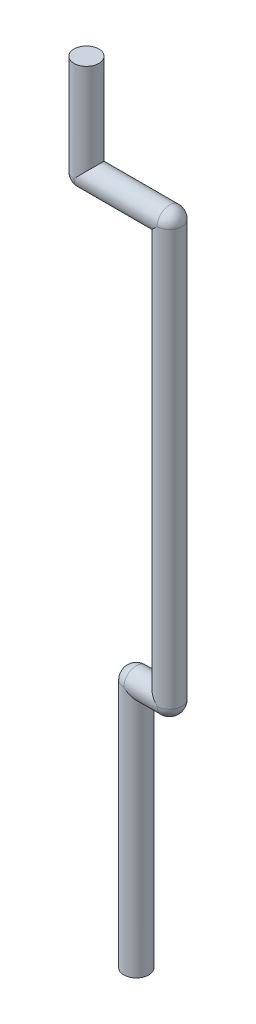
from build123d import *

# Parameters (mm, degrees)
SKETCH_1_R      = 0.75
EXTRUDE_1_DEPTH = 15
SKETCH_3_R      = 0.75
EXTRUDE_2_DEPTH = 2
SKETCH_5_R      = 0.75
EXTRUDE_3_DEPTH = 25
SKETCH_7_R      = 0.75
EXTRUDE_4_DEPTH = 5
EXTRUDE_START   = 25
SKETCH_9_R      = 0.75
EXTRUDE_5_DEPTH = 6


with BuildPart() as part:
    # 草图1 → 凸台-拉伸1 (new body)
    with BuildSketch(Plane(origin=(0, 0, 0), x_dir=(1, 0, 0), z_dir=(0, 1, 0))):
        with Locations(Location((0, 0, 0), (0, 0, 270))):
            Circle(SKETCH_1_R)
    extrude(amount=EXTRUDE_1_DEPTH)

    # 草图2 → 旋转1 (revolve)
    with BuildSketch(Plane.XY):
        with BuildLine():
            Line((0, 15.75), (0, 14.25))
            ThreePointArc((0, 14.25), (0.75, 15), (0, 15.75))
        make_face()
    revolve(axis=Axis((0, 15.75, 0), (0, -1, 0)))

    # 草图3 → 凸台-拉伸2 (add)
    with BuildSketch(Plane(origin=(0, 0, 0), x_dir=(0, 0, -1), z_dir=(1, 0, 0))):
        with Locations((0, 15)):
            Circle(SKETCH_3_R)
    extrude(amount=EXTRUDE_2_DEPTH)

    # 草图4 → 旋转2 (revolve)
    with BuildSketch(Plane(origin=(2, 0, 0), x_dir=(0, 0, -1), z_dir=(1, 0, 0))):
        with BuildLine():
            Line((0, 15.75), (0, 14.25))
            ThreePointArc((0, 14.25), (0.75, 15), (0, 15.75))
        make_face()
    revolve(axis=Axis((2, 15.75, 0), (0, -1, 0)))

    # 草图5 → 凸台-拉伸3 (add)
    with BuildSketch(Plane(origin=(0, 15, 0), x_dir=(1, 0, 0), z_dir=(0, 1, 0))):
        with Locations(Location((2, 0, 0), (0, 0, 270))):
            Circle(SKETCH_5_R)
    extrude(amount=EXTRUDE_3_DEPTH)

    # 草图6 → 旋转3 (revolve)
    with BuildSketch(Plane(origin=(0, 40, 0), x_dir=(1, 0, 0), z_dir=(0, 1, 0))):
        with BuildLine():
            Line((2, 0.75), (2, -0.75))
            ThreePointArc((2, -0.75), (2.75, 0), (2, 0.75))
        make_face()
    revolve(axis=Axis((2, 40, -0.75), (0, 0, 1)))

    # 草图7 → 凸台-拉伸4 (add)
    with BuildSketch(Plane(origin=(2, 0, 0), x_dir=(0, 0, -1), z_dir=(1, 0, 0))):
        with Locations((0, 40)):
            Circle(SKETCH_7_R)
    extrude(amount=-EXTRUDE_4_DEPTH)

    # 草图8 → 旋转5 (revolve)
    with BuildSketch(Plane.ZY.offset(3)):
        with BuildLine():
            Line((-0.75, 40), (0.75, 40))
            ThreePointArc((0.75, 40), (0, 40.75), (-0.75, 40))
        make_face()
    revolve(axis=Axis((-3, 40, -0.75), (0, 0, 1)))

    # 草图9 → 凸台-拉伸5 (add)
    with BuildSketch(Plane(origin=(0, 15, 0), x_dir=(1, 0, 0), z_dir=(0, 1, 0)).offset(EXTRUDE_START)):
        with Locations(Location((-3, 0, 0), (0, 0, 270))):
            Circle(SKETCH_9_R)
    extrude(amount=EXTRUDE_5_DEPTH)


solid = part.part
